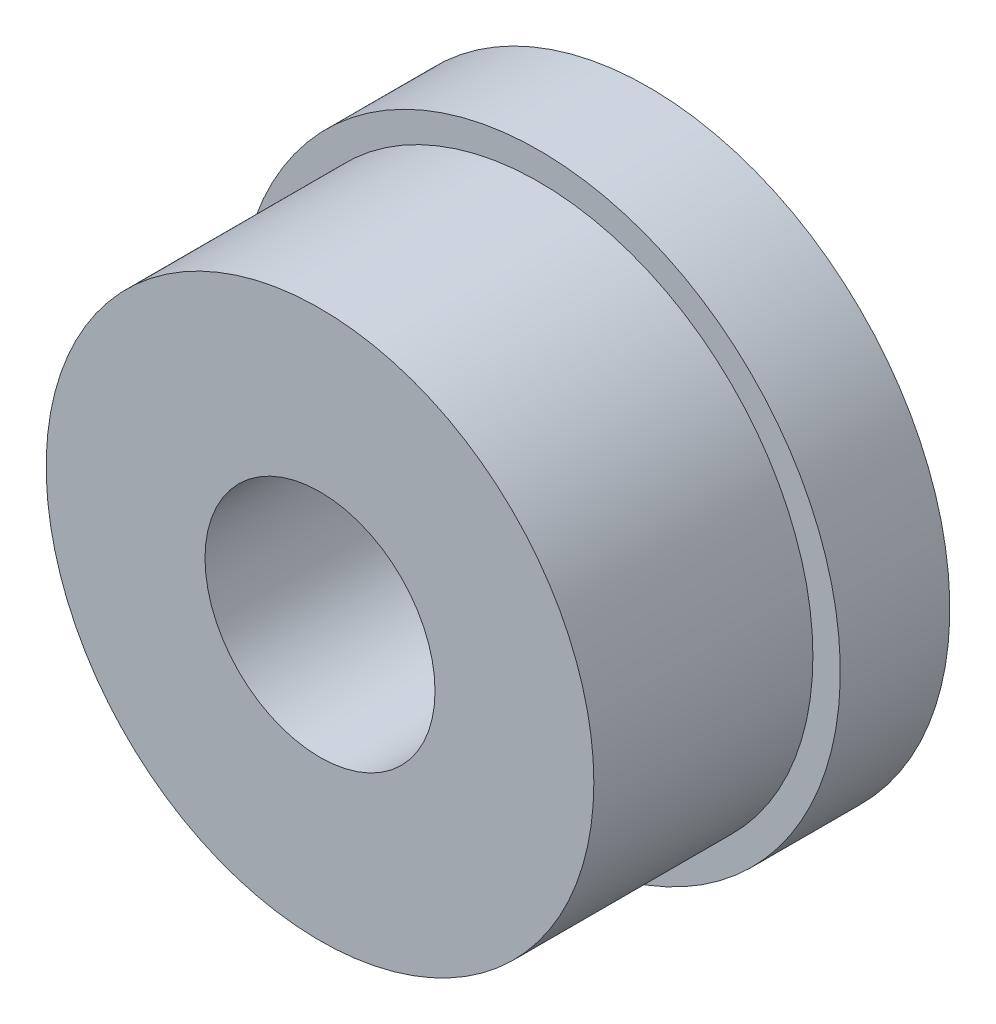
from build123d import *

# Parameters (mm, degrees)
SKETCH_1_R          = 5
EXTRUDE_1_DEPTH     = 4
SKETCH_2_R          = 5.5
EXTRUDE_2_DEPTH     = 2
SKETCH_3_R          = 2.1
CUT_EXTRUDE_1_DEPTH = 10.823441352
SKETCH_4_R          = 4
CUT_EXTRUDE_2_DEPTH = 3


with BuildPart() as part:
    # ｽｹｯﾁ1 → ﾎﾞｽ - 押し出し1 (new body)
    with BuildSketch(Plane.XY):
        Circle(SKETCH_1_R)
    extrude(amount=EXTRUDE_1_DEPTH)

    # ｽｹｯﾁ2 → ﾎﾞｽ - 押し出し2 (add)
    with BuildSketch(Plane(origin=(0, 0, 0), x_dir=(-1, 0, 0), z_dir=(0, 0, -1))):
        Circle(SKETCH_2_R)
    extrude(amount=EXTRUDE_2_DEPTH)

    # ｽｹｯﾁ3 → ｶｯﾄ - 押し出し1 (cut, through all)
    with BuildSketch(Plane.XY.offset(4)):
        Circle(SKETCH_3_R)
    extrude(amount=-CUT_EXTRUDE_1_DEPTH, mode=Mode.SUBTRACT)

    # ｽｹｯﾁ4 → ｶｯﾄ - 押し出し2 (cut)
    with BuildSketch(Plane(origin=(0, 0, -2), x_dir=(-1, 0, 0), z_dir=(0, 0, -1))):
        Circle(SKETCH_4_R)
    extrude(amount=-CUT_EXTRUDE_2_DEPTH, mode=Mode.SUBTRACT)


solid = part.part
